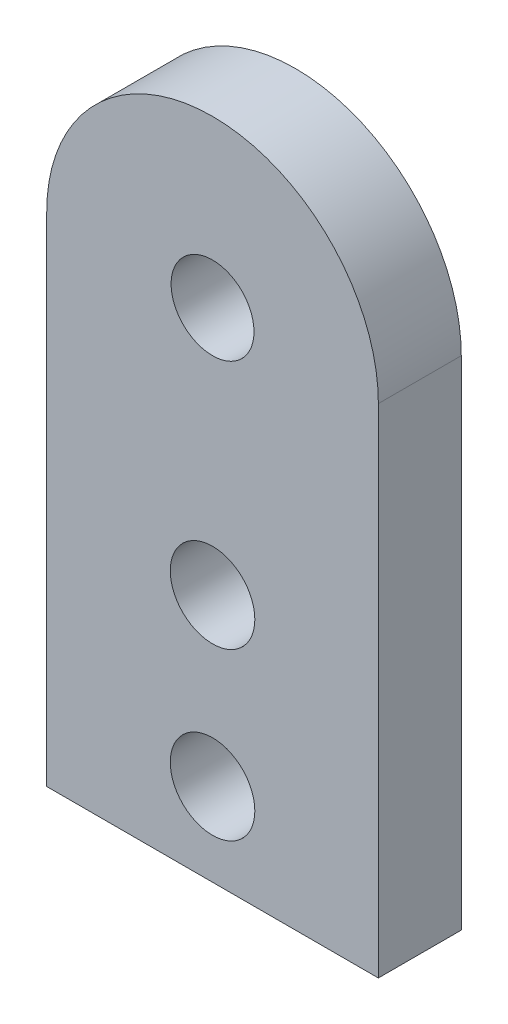
from build123d import *

# Parameters (mm, degrees)
SKETCH1_R           = 2.55
BOSS_EXTRUDE1_DEPTH = 5
SKETCH2_R           = 2.5
CUT_EXTRUDE1_DEPTH  = 5


with BuildPart() as part:
    # Sketch1 → Boss-Extrude1 (new body)
    with BuildSketch(Plane.XY):
        with BuildLine():
            Line((-10, 0), (-10, -30))
            Line((-10, -30), (10, -30))
            Line((10, -30), (10, 0))
            ThreePointArc((10, 0), (0, 10), (-10, 0))
        make_face()
        with Locations((0, -25)):
            Circle(SKETCH1_R, mode=Mode.SUBTRACT)
        with Locations((0, -15)):
            Circle(SKETCH1_R, mode=Mode.SUBTRACT)
    extrude(amount=BOSS_EXTRUDE1_DEPTH)

    # Sketch2 → Cut-Extrude1 (cut)
    with BuildSketch(Plane.XY.offset(5)):
        Circle(SKETCH2_R)
    extrude(amount=-CUT_EXTRUDE1_DEPTH, mode=Mode.SUBTRACT)


solid = part.part
